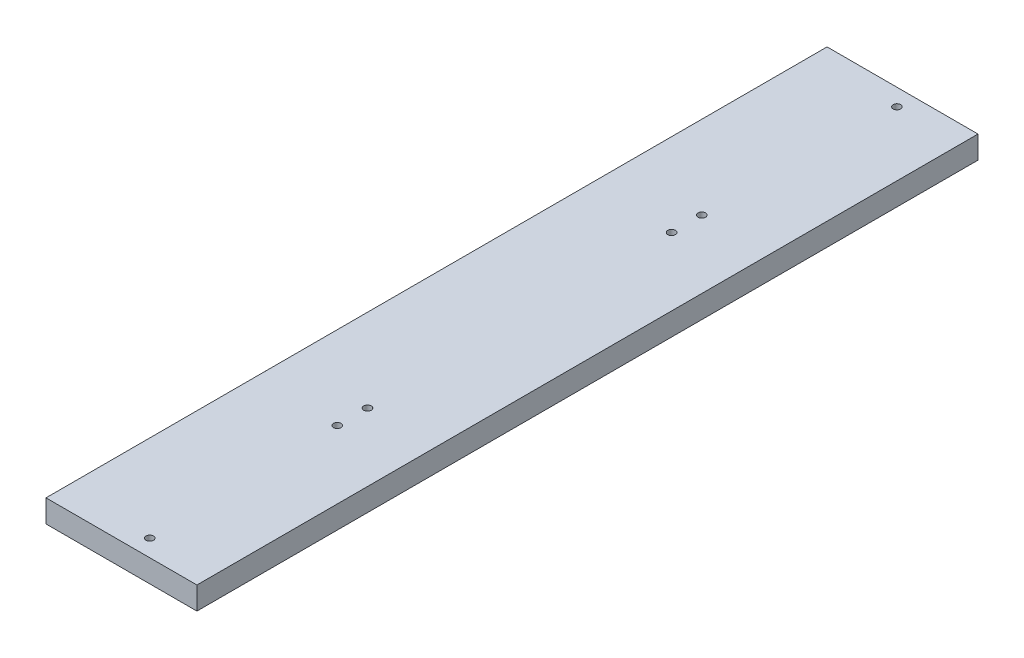
from build123d import *

# Parameters (mm, degrees)
SKETCH1_W                   = 127
SKETCH1_H                   = 657.225
BOSS_EXTRUDE1_DEPTH         = 19.05
F_1_4_0_25_DIAMETER_HOLE1_D = 6.35


with BuildPart() as part:
    # Sketch1 → Boss-Extrude1 (new body)
    with BuildSketch(Plane(origin=(0, 0, 0), x_dir=(1, 0, 0), z_dir=(0, 1, 0))):
        with Locations((63.5, -328.6125)):
            Rectangle(SKETCH1_W, SKETCH1_H)
    extrude(amount=BOSS_EXTRUDE1_DEPTH)

    # 1/4 (0.25) Diameter Hole1 (through all)
    with Locations(Plane(origin=(0, 0, 0), x_dir=(-1, 0, 0), z_dir=(0, -1, 0))):
        with Locations((-73.025, -14.2875), (-69.85, -175.26), (-69.85, -200.66), (-69.85, -456.565), (-69.85, -481.965), (-73.025, -642.9375)):
            Hole(F_1_4_0_25_DIAMETER_HOLE1_D / 2)


solid = part.part
